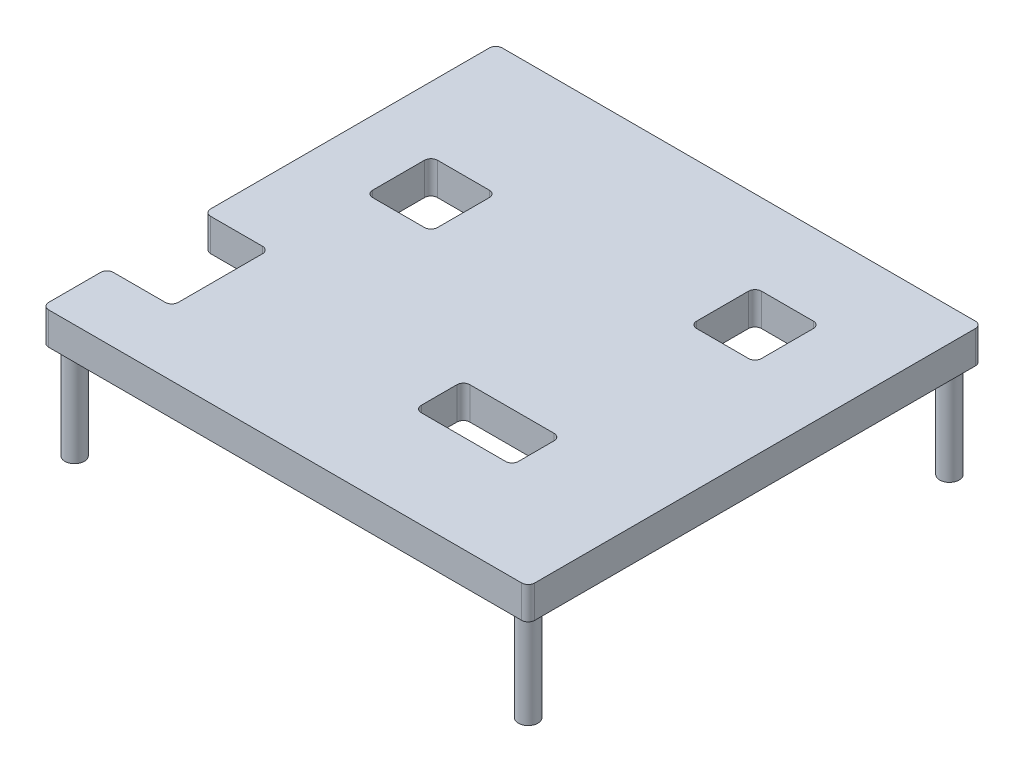
from build123d import *

# Parameters (mm, degrees)
SKETCH1_W           = 150
SKETCH1_H           = 140
BOSS_EXTRUDE1_DEPTH = 10
SKETCH2_R           = 3
BOSS_EXTRUDE2_DEPTH = 30
SKETCH4_W           = 20
SKETCH4_H           = 20
CUT_EXTRUDE2_DEPTH  = 111.113577728
SKETCH6_W           = 20
SKETCH6_H           = 30
CUT_EXTRUDE3_DEPTH  = 111.113577728
SKETCH7_W           = 30
SKETCH7_H           = 15
CUT_EXTRUDE4_DEPTH  = 111.113577728
SKETCH8_W           = 20
SKETCH8_H           = 20
CUT_EXTRUDE5_DEPTH  = 111.113577728
FILLET2_R           = 2


with BuildPart() as part:
    # Sketch1 → Boss-Extrude1 (new body)
    with BuildSketch(Plane(origin=(0, 0, 0), x_dir=(1, 0, 0), z_dir=(0, 1, 0))):
        Rectangle(SKETCH1_W, SKETCH1_H)
    extrude(amount=BOSS_EXTRUDE1_DEPTH)

    # Sketch2 → Boss-Extrude2 (add)
    with BuildSketch(Plane.XZ):
        with Locations(Location((-70, 65, 0), (0, 0, 90))):
            Circle(SKETCH2_R)
        with Locations(Location((70, 65, 0), (0, 0, 90))):
            Circle(SKETCH2_R)
        with Locations(Location((70, -65, 0), (0, 0, 90))):
            Circle(SKETCH2_R)
        with Locations(Location((-70, -65, 0), (0, 0, 90))):
            Circle(SKETCH2_R)
    extrude(amount=BOSS_EXTRUDE2_DEPTH)

    # Sketch4 → Cut-Extrude2 (cut, through all)
    with BuildSketch(Plane(origin=(0, 10, 0), x_dir=(1, 0, 0), z_dir=(0, 1, 0))):
        with Locations((-45, 20)):
            Rectangle(SKETCH4_W, SKETCH4_H)
    extrude(amount=-CUT_EXTRUDE2_DEPTH, mode=Mode.SUBTRACT)

    # Sketch6 → Cut-Extrude3 (cut, through all)
    with BuildSketch(Plane(origin=(0, 10, 0), x_dir=(1, 0, 0), z_dir=(0, 1, 0))):
        with Locations((-65, -35)):
            Rectangle(SKETCH6_W, SKETCH6_H)
    extrude(amount=-CUT_EXTRUDE3_DEPTH, mode=Mode.SUBTRACT)

    # Sketch7 → Cut-Extrude4 (cut, through all)
    with BuildSketch(Plane(origin=(0, 10, 0), x_dir=(1, 0, 0), z_dir=(0, 1, 0))):
        with Locations((25, -32.5)):
            Rectangle(SKETCH7_W, SKETCH7_H)
    extrude(amount=-CUT_EXTRUDE4_DEPTH, mode=Mode.SUBTRACT)

    # Sketch8 → Cut-Extrude5 (cut, through all)
    with BuildSketch(Plane(origin=(0, 10, 0), x_dir=(1, 0, 0), z_dir=(0, 1, 0))):
        with Locations((40, 35)):
            Rectangle(SKETCH8_W, SKETCH8_H)
    extrude(amount=-CUT_EXTRUDE5_DEPTH, mode=Mode.SUBTRACT)

    # Fillet2
    fillet2_edges = [part.edges().sort_by_distance(p)[0] for p in [
        (-35, 5, -30),
        (-35, 5, -10),
        (-55, 5, -10),
        (-55, 5, -30),
        (-75, 5, 50),
        (-75, 5, 20),
        (-55, 5, 20),
        (-55, 5, 50),
        (40, 5, 25),
        (40, 5, 40),
        (10, 5, 40),
        (10, 5, 25),
        (-75, 5, -70),
        (75, 5, -70),
        (75, 5, 70),
        (-75, 5, 70),
        (30, 5, -25),
        (30, 5, -45),
        (50, 5, -45),
        (50, 5, -25),
    ]]
    fillet(fillet2_edges, radius=FILLET2_R)


solid = part.part
